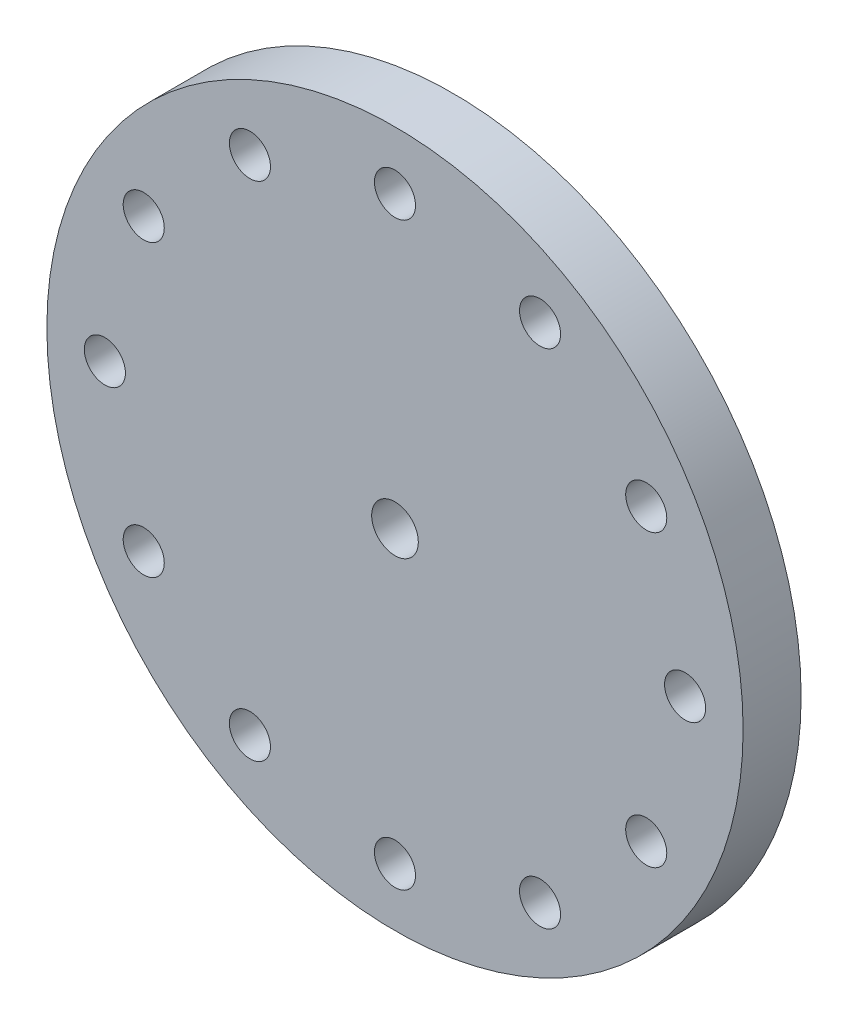
from build123d import *

# Parameters (mm, degrees)
SKETCH1_R                 = 38.1
BOSS_EXTRUDE1_DEPTH       = 6.35
F_1_4_20_TAPPED_HOLE1_D   = 5.1054
F_8_CLEARANCE_HOLE1_D     = 4.4958
F_8_CLEARANCE_HOLE1_DEPTH = 313.436
F_8_CLEARANCE_HOLE1_TIP   = 1.350674586


with BuildPart() as part:
    # Sketch1 → Boss-Extrude1 (new body)
    with BuildSketch(Plane.XY):
        Circle(SKETCH1_R)
    extrude(amount=BOSS_EXTRUDE1_DEPTH)

    # 1/4-20 Tapped Hole1 (through all)
    with Locations(Plane.XY.offset(6.35)):
        with Locations((0, 0)):
            Hole(F_1_4_20_TAPPED_HOLE1_D / 2)

    # #8 Clearance Hole1
    with Locations(Plane.XY.offset(6.35)):
        with Locations((-31.75, 0), (-27.49630657, 15.875), (-15.875, 27.49630657), (0, 31.75), (15.875, 27.49630657), (27.49630657, 15.875), (31.75, 0), (27.49630657, -15.875), (15.875, -27.49630657), (0, -31.75), (-15.875, -27.49630657), (-27.49630657, -15.875)):
            Hole(F_8_CLEARANCE_HOLE1_D / 2, depth=F_8_CLEARANCE_HOLE1_DEPTH)
            with Locations((0, 0, -(F_8_CLEARANCE_HOLE1_DEPTH + F_8_CLEARANCE_HOLE1_TIP / 2))):  # 118° drill point
                Cone(0, F_8_CLEARANCE_HOLE1_D / 2, F_8_CLEARANCE_HOLE1_TIP, mode=Mode.SUBTRACT)


solid = part.part
